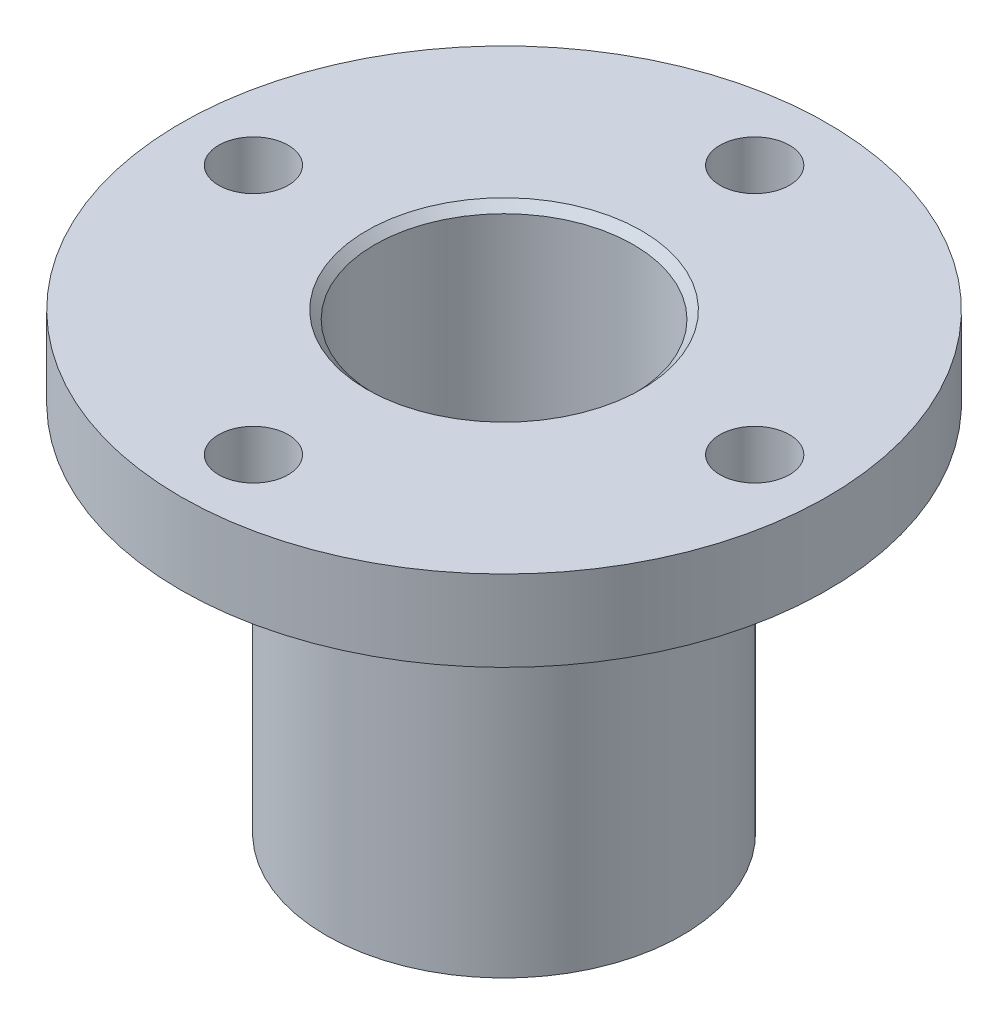
from build123d import *

# Parameters (mm, degrees)
SKETCH_1_R          = 11
EXTRUDE_1_DEPTH     = 23
SKETCH_2_R          = 20
EXTRUDE_2_DEPTH     = 5
SKETCH_3_R          = 8
CUT_EXTRUDE_1_DEPTH = 40.799497484
CHAMFER_1_SIZE      = 0.5
SKETCH_4_R          = 2.15
CUT_EXTRUDE_2_DEPTH = 40.799497484


with BuildPart() as part:
    # 草图1 → 凸台-拉伸1 (new body)
    with BuildSketch(Plane(origin=(0, 0, 0), x_dir=(1, 0, 0), z_dir=(0, 1, 0))):
        with Locations(Location((0, 0, 0), (0, 0, 270))):
            Circle(SKETCH_1_R)
    extrude(amount=EXTRUDE_1_DEPTH)

    # 草图2 → 凸台-拉伸2 (add)
    with BuildSketch(Plane(origin=(0, 23, 0), x_dir=(1, 0, 0), z_dir=(0, 1, 0))):
        with Locations(Location((0, 0, 0), (0, 0, 270))):
            Circle(SKETCH_2_R)
    extrude(amount=EXTRUDE_2_DEPTH)

    # 草图3 → 切除-拉伸1 (cut, through all)
    with BuildSketch(Plane(origin=(0, 28, 0), x_dir=(1, 0, 0), z_dir=(0, 1, 0))):
        with Locations(Location((0, 0, 0), (0, 0, 270))):
            Circle(SKETCH_3_R)
    extrude(amount=-CUT_EXTRUDE_1_DEPTH, mode=Mode.SUBTRACT)

    # 倒角1
    chamfer_1_edges = [part.edges().sort_by_distance(p)[0] for p in [
        (0, 0, -8),
        (0, 28, -8),
    ]]
    chamfer(chamfer_1_edges, length=CHAMFER_1_SIZE)

    # 草图4 → 切除-拉伸2 (cut, through all)
    with BuildSketch(Plane(origin=(0, 28, 0), x_dir=(1, 0, 0), z_dir=(0, 1, 0))):
        with Locations(Location((0, 15.5, 0), (0, 0, 270))):
            Circle(SKETCH_4_R)
        with Locations(Location((15.5, 0, 0), (0, 0, 270))):
            Circle(SKETCH_4_R)
        with Locations(Location((0, -15.5, 0), (0, 0, 270))):
            Circle(SKETCH_4_R)
        with Locations(Location((-15.5, 0, 0), (0, 0, 270))):
            Circle(SKETCH_4_R)
    extrude(amount=-CUT_EXTRUDE_2_DEPTH, mode=Mode.SUBTRACT)


solid = part.part
